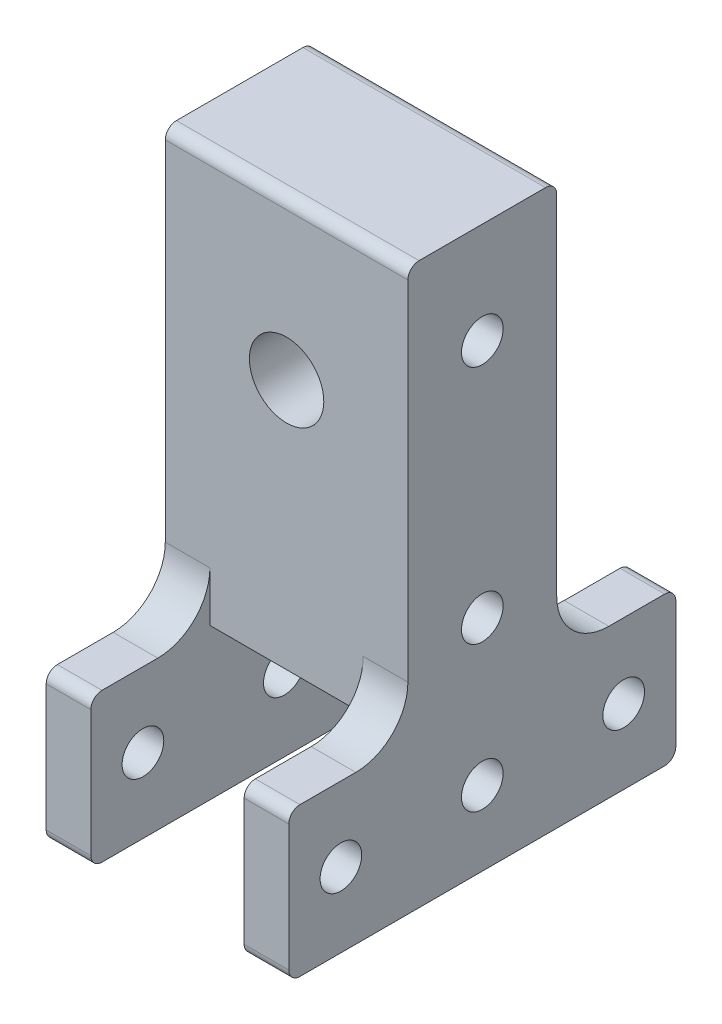
from build123d import *

# Parameters (mm, degrees)
EXTRUDE1_DEPTH      = 10.3
EXTRUDE1_DEPTH_BACK = 10.3
SKETCH1_W           = 20
SKETCH1_H           = 55
EXTRUDE2_DEPTH      = 6
SKETCH4_R           = 2.8
EXTRUDE3_DEPTH      = 78.478061411
SKETCH5_R           = 5
EXTRUDE4_DEPTH      = 77.326797391
FILLET2_R           = 1.5


with BuildPart() as part:
    # Sketch1 → Extrude1 (new, two sides: drawn at the far end of the back side and taken through both)
    with BuildSketch(Plane(origin=(0, 0, 0), x_dir=(0, 0, -1), z_dir=(1, 0, 0)).offset(-EXTRUDE1_DEPTH_BACK)):
        with Locations((0, 37.8)):
            Rectangle(SKETCH1_W, SKETCH1_H)
    extrude(amount=EXTRUDE1_DEPTH + EXTRUDE1_DEPTH_BACK)

    # Sketch2 → Extrude2 (add)
    with BuildSketch(Plane(origin=(10.3, 0, 0), x_dir=(0, 0, -1), z_dir=(1, 0, 0))):
        with BuildLine():
            Line((26, 10), (17, 10))
            ThreePointArc((17, 10), (12.050252532, 12.050252532), (10, 17))
            Line((10, 17), (10, 65.3))
            Line((10, 65.3), (-10, 65.3))
            Line((-10, 65.3), (-10, 17))
            ThreePointArc((-10, 17), (-12.050252532, 12.050252532), (-17, 10))
            Line((-17, 10), (-26, 10))
            Line((-26, 10), (-26, -10))
            Line((-26, -10), (26, -10))
            Line((26, -10), (26, 10))
        make_face()
    extrude2 = extrude(amount=EXTRUDE2_DEPTH)

    # Mirror2: Extrude2 across plane
    add(extrude2.mirror(Plane(origin=(0, 0, 0), x_dir=(0, 0, 1), z_dir=(1, 0, 0))))

    # Sketch4 → Extrude3 (cut, through all)
    with BuildSketch(Plane(origin=(16.3, 0, 0), x_dir=(0, 0, -1), z_dir=(1, 0, 0))):
        Circle(SKETCH4_R)
        with Locations((19, 0)):
            Circle(SKETCH4_R)
        with Locations((-19, 0)):
            Circle(SKETCH4_R)
        with Locations((0, 19.5)):
            Circle(SKETCH4_R)
        with Locations((0, 51.75)):
            Circle(SKETCH4_R)
    extrude(amount=-EXTRUDE3_DEPTH, mode=Mode.SUBTRACT)

    # Sketch5 → Extrude4 (cut, through all)
    with BuildSketch(Plane.XY.offset(10)):
        with Locations((0, 44)):
            Circle(SKETCH5_R)
    extrude(amount=-EXTRUDE4_DEPTH, mode=Mode.SUBTRACT)

    # Fillet2
    fillet2_edges = [part.edges().sort_by_distance(p)[0] for p in [
        (13.3, -10, 26),
        (13.3, 10, 26),
        (-13.3, 10, 26),
        (-13.3, -10, 26),
        (-13.3, -10, -26),
        (13.3, -10, -26),
        (13.3, 10, -26),
        (-13.3, 10, -26),
        (0, 65.3, 10),
        (0, 65.3, -10),
    ]]
    fillet(fillet2_edges, radius=FILLET2_R)


solid = part.part
